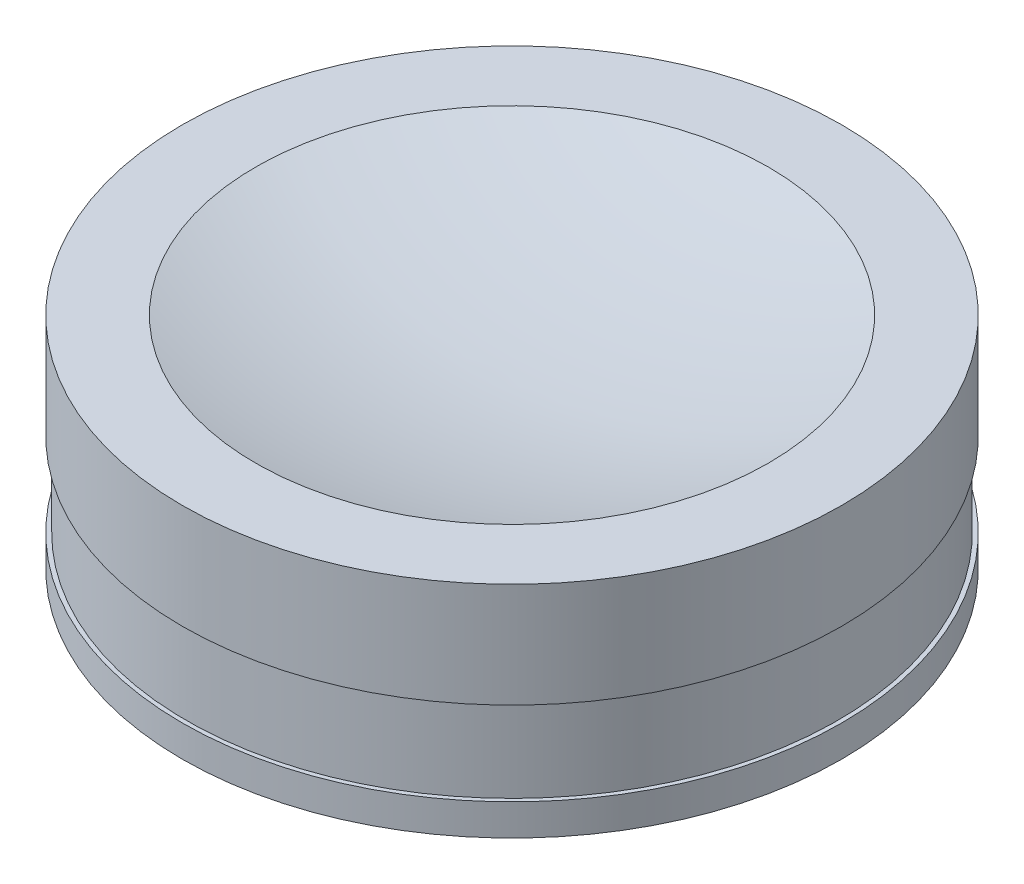
from build123d import *


with BuildPart() as part:
    # Sketch1 → Revolve1 (revolve)
    with BuildSketch(Plane.XY, mode=Mode.PRIVATE) as revolve1_sk:
        with BuildLine():
            Line((0, 29.4), (0, 34.4))
            ThreePointArc((0, 34.4), (24.792942544, 36.311291491), (49, 42))
            Line((49, 42), (63, 42))
            Line((63, 42), (63, 22))
            Line((63, 22), (62.2, 22))
            Line((62.2, 22), (62.2, 6))
            Line((62.2, 6), (63, 6))
            Line((63, 6), (63, 0))
            Line((63, 0), (58, 0))
            Line((58, 0), (58, 6.5))
            ThreePointArc((58, 6.5), (56.5, 8), (58, 9.5))
            Line((58, 9.5), (58, 12.5))
            ThreePointArc((58, 12.5), (56.5, 14), (58, 15.5))
            Line((58, 15.5), (58, 37))
            Line((58, 37), (49, 37))
            ThreePointArc((49, 37), (24.792942544, 31.311291491), (0, 29.4))
        make_face()
    revolve(revolve1_sk.sketch.rotate(Axis((0, 0, 0), (0, 1, 0)), 90), axis=Axis((0, 0, 0), (0, 1, 0)))


solid = part.part
